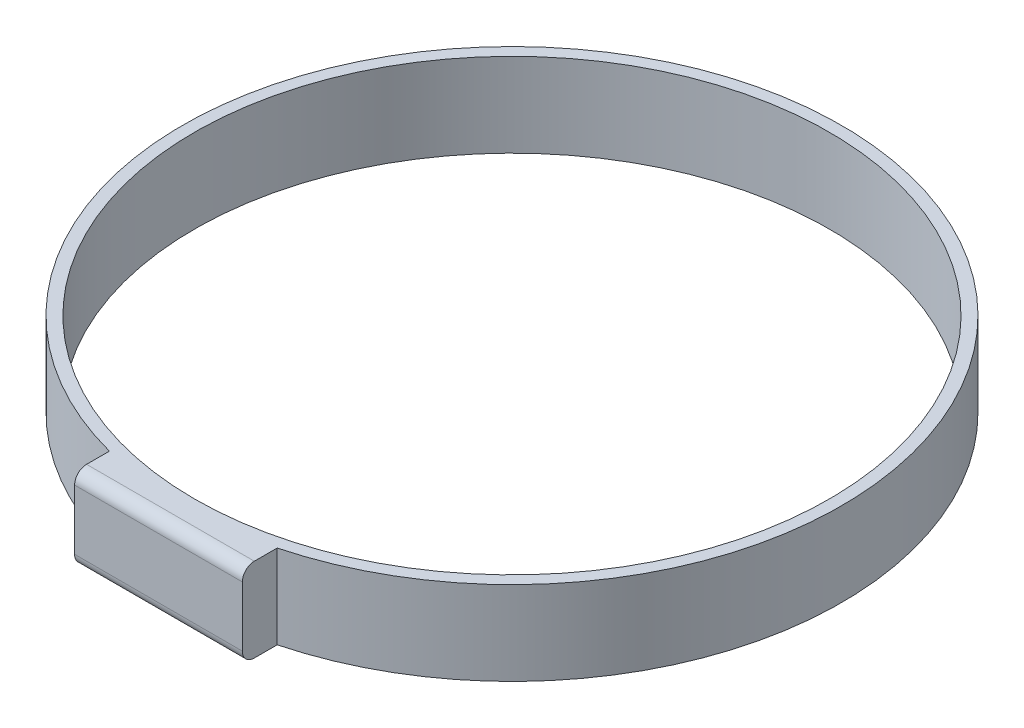
from build123d import *

# Parameters (mm, degrees)
SKETCH1_R           = 27.5
SKETCH1_R_2         = 26.5
BOSS_EXTRUDE1_DEPTH = 7
SKETCH2_W           = 14
SKETCH2_H           = 7
BOSS_EXTRUDE2_DEPTH = 3
FILLET1_R           = 1


with BuildPart() as part:
    # Sketch1 → Boss-Extrude1 (new body)
    with BuildSketch(Plane(origin=(0, 0, 0), x_dir=(1, 0, 0), z_dir=(0, 1, 0))):
        with Locations(Location((0, 0, 0), (0, 0, 270))):
            Circle(SKETCH1_R)
        with Locations(Location((0, 0, 0), (0, 0, 270))):
            Circle(SKETCH1_R_2, mode=Mode.SUBTRACT)
    extrude(amount=BOSS_EXTRUDE1_DEPTH)

    # Sketch2 → Boss-Extrude2 (add)
    with BuildSketch(Plane.XY.offset(26.5)):
        with Locations((0, 3.5)):
            Rectangle(SKETCH2_W, SKETCH2_H)
    extrude(amount=BOSS_EXTRUDE2_DEPTH)

    # Fillet1
    fillet1_edges = [part.edges().sort_by_distance(p)[0] for p in [
        (0, 0, 29.5),
        (0, 7, 29.5),
    ]]
    fillet(fillet1_edges, radius=FILLET1_R)


solid = part.part
